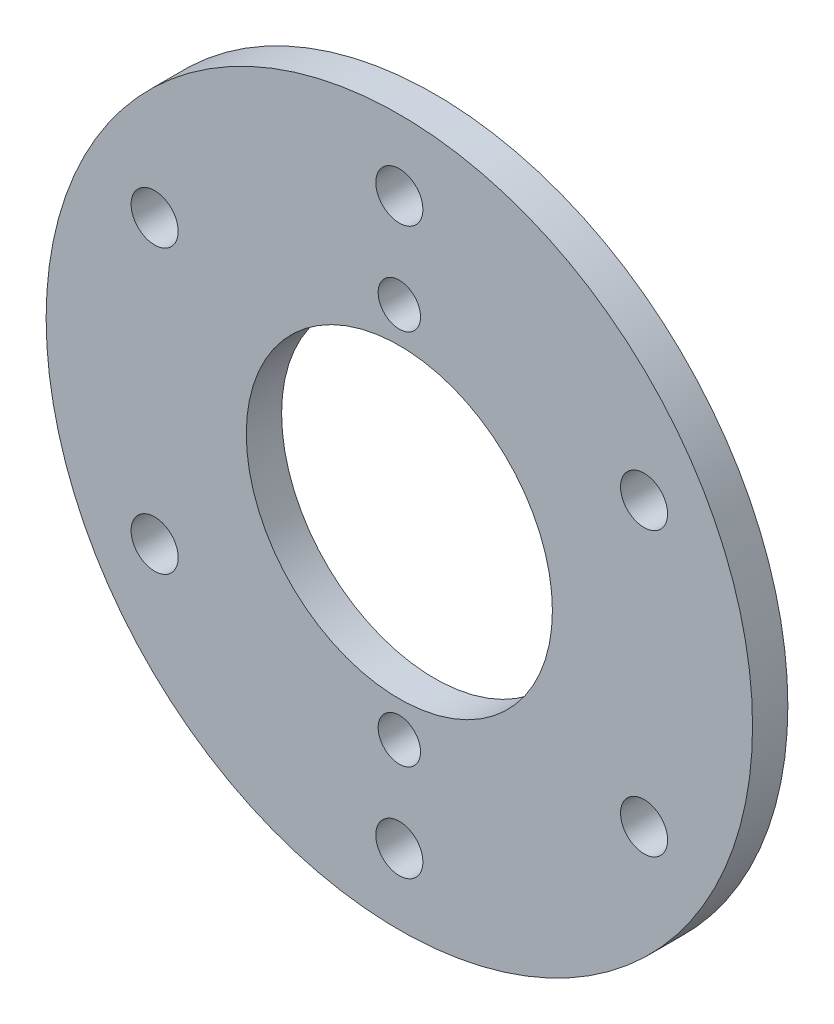
from build123d import *

# Parameters (mm, degrees)
SKETCH1_R             = 150
SKETCH1_R_2           = 65
BOSS_EXTRUDE1_DEPTH   = 15
F_1_0MM_DOWEL_HOLE1_D = 20
CIRPATTERN1_COUNT     = 6
F_1_0MM_DOWEL_HOLE2_D = 18


with BuildPart() as part:
    # Sketch1 → Boss-Extrude1 (new body)
    with BuildSketch(Plane.XY):
        Circle(SKETCH1_R)
        Circle(SKETCH1_R_2, mode=Mode.SUBTRACT)
    extrude(amount=BOSS_EXTRUDE1_DEPTH)

    # Ø1.0mm Dowel Hole1 (through all)
    with Locations(Plane.XY.offset(15)):
        with Locations((0, 120)):
            f_1_0mm_dowel_hole1 = Hole(F_1_0MM_DOWEL_HOLE1_D / 2)

    # CirPattern1: Ø1.0mm Dowel Hole1 ×6 about axis
    cirpattern1_axis = Axis((0, 0, 0), (0, 0, 1))
    for i in range(1, CIRPATTERN1_COUNT):
        add(f_1_0mm_dowel_hole1.rotate(cirpattern1_axis, i * 360 / CIRPATTERN1_COUNT), mode=Mode.SUBTRACT)

    # Ø1.0mm Dowel Hole2 (through all)
    with Locations(Plane.XY.offset(15)):
        with Locations((0, 80), (0, -80)):
            Hole(F_1_0MM_DOWEL_HOLE2_D / 2)


solid = part.part
